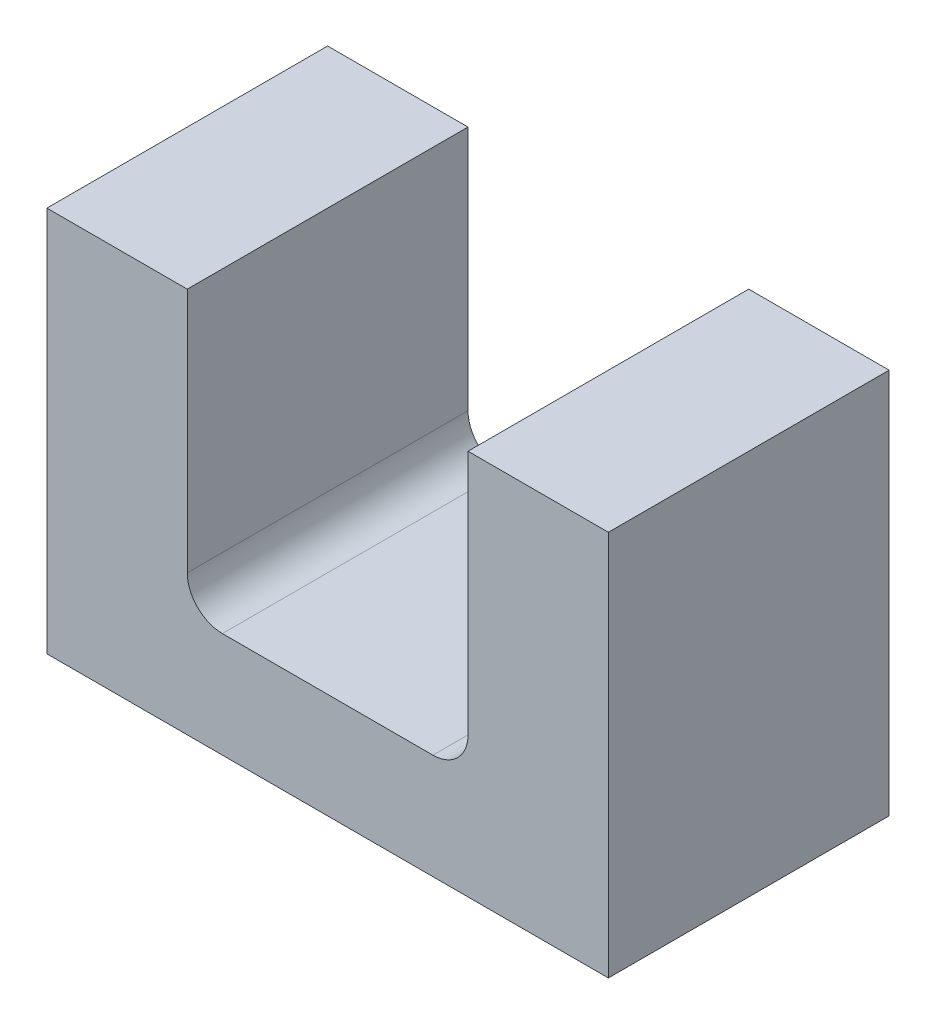
from build123d import *

# Parameters (mm, degrees)
SKETCH_1_W        = 2
SKETCH_1_H        = 4
EXTRUDE_1_DEPTH   = 5.5
EXTRUDE_1_2_DEPTH = 5.5
SKETCH_1_3_W      = 4
SKETCH_1_3_H      = 4
EXTRUDE_2_DEPTH   = 1.5
FILLET_1_R        = 0.5


with BuildPart() as part:
    # 草图1 → 凸台-拉伸1 (new body)
    with BuildSketch(Plane(origin=(0, 0, 0), x_dir=(1, 0, 0), z_dir=(0, 1, 0))):
        with Locations((-3, 0)):
            Rectangle(SKETCH_1_W, SKETCH_1_H)
    extrude(amount=EXTRUDE_1_DEPTH)



with BuildPart() as body_2:
    # 草图1 → Extrude 1 2 (new body)
    with BuildSketch(Plane(origin=(0, 0, 0), x_dir=(1, 0, 0), z_dir=(0, 1, 0))):
        with Locations((3, 0)):
            Rectangle(SKETCH_1_W, SKETCH_1_H)
    extrude(amount=EXTRUDE_1_2_DEPTH)


with BuildPart() as part_1:
    add(part.part)

    add(body_2.part)  # 凸台-拉伸2 merges body 2
    # 草图1<3> → 凸台-拉伸2 (add)
    with BuildSketch(Plane(origin=(0, 0, 0), x_dir=(1, 0, 0), z_dir=(0, 1, 0))):
        Rectangle(SKETCH_1_3_W, SKETCH_1_3_H)
    extrude(amount=EXTRUDE_2_DEPTH)

    # 圆角1
    fillet_1_edges = [part_1.edges().sort_by_distance(p)[0] for p in [
        (2, 1.5, 0),
        (-2, 1.5, 0),
    ]]
    fillet(fillet_1_edges, radius=FILLET_1_R)


solid = part_1.part
